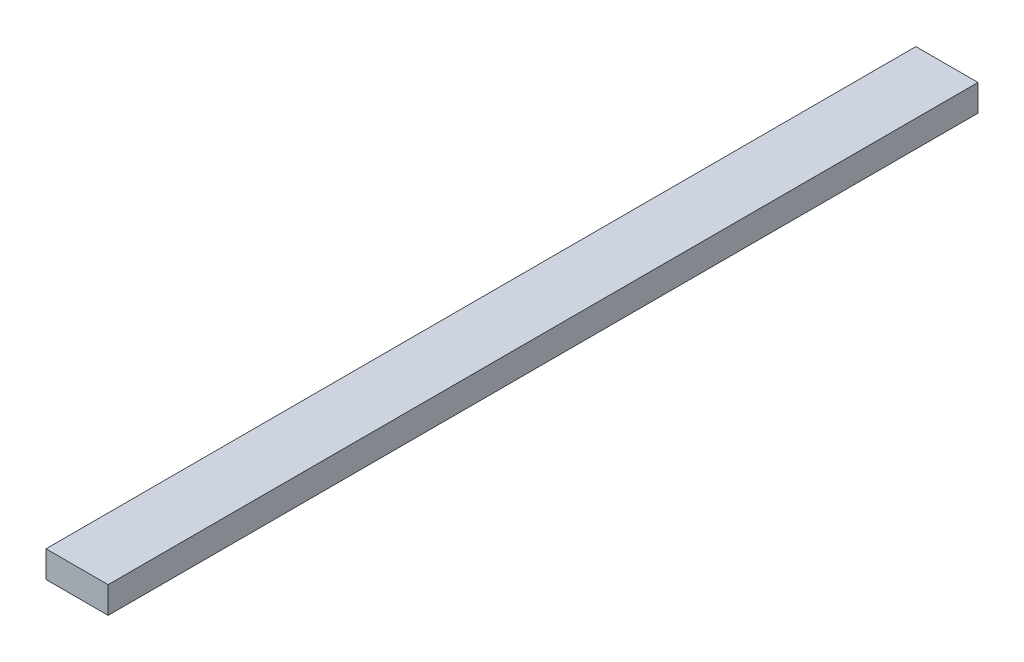
from build123d import *

# Parameters (mm, degrees)
SKETCH1_W           = 88.9
SKETCH1_H           = 38.1
BOSS_EXTRUDE1_DEPTH = 622.3


with BuildPart() as part:
    # Sketch1 → Boss-Extrude1 (new, symmetric)
    with BuildSketch(Plane.XY):
        Rectangle(SKETCH1_W, SKETCH1_H)
    extrude(amount=BOSS_EXTRUDE1_DEPTH, both=True)


solid = part.part
